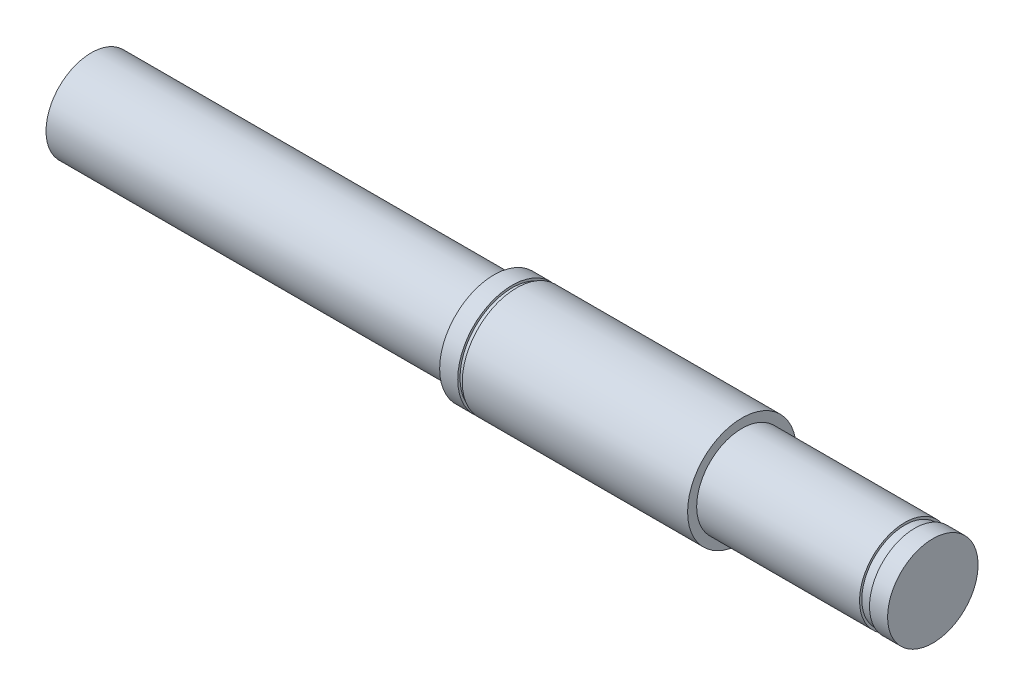
from build123d import *


with BuildPart() as part:
    # Sketch7 → Revolve1 (revolve)
    with BuildSketch(Plane.XY, mode=Mode.PRIVATE) as revolve1_sk:
        Polygon((-2, 5), (-2, 6), (0, 6), (0, 5.749556412), (0.5, 5.749556412), (0.5, 6), (25.4, 6), (25.4, 5), (43.4, 5), (43.4, 4.75), (44.5, 4.75), (44.5, 5), (46.5, 5), (46.5, 0), (-46.5, 0), (-46.5, 5), align=None)
    revolve(revolve1_sk.sketch.rotate(Axis((0, 0, 0), (1, 0, 0)), 90), axis=Axis((0, 0, 0), (1, 0, 0)))


solid = part.part
